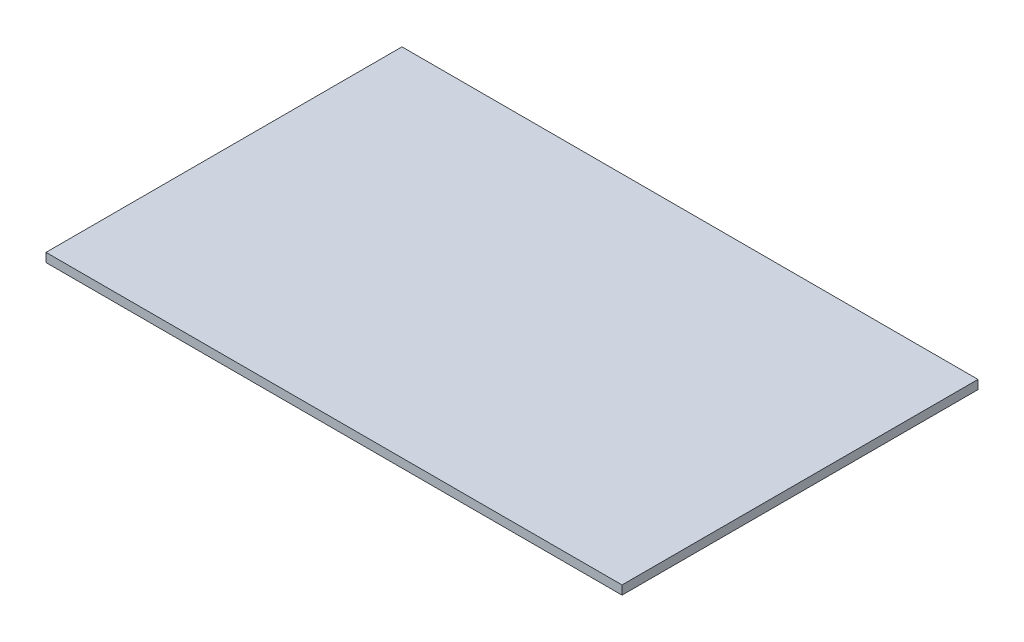
from build123d import *

# Parameters (mm, degrees)
SKETCH1_W           = 412
SKETCH1_H           = 254.6
BOSS_EXTRUDE1_DEPTH = 6.35


with BuildPart() as part:
    # Sketch1 → Boss-Extrude1 (new body)
    with BuildSketch(Plane(origin=(0, 0, 0), x_dir=(1, 0, 0), z_dir=(0, 1, 0))):
        with Locations((206, 127.3)):
            Rectangle(SKETCH1_W, SKETCH1_H)
    extrude(amount=BOSS_EXTRUDE1_DEPTH)


solid = part.part
